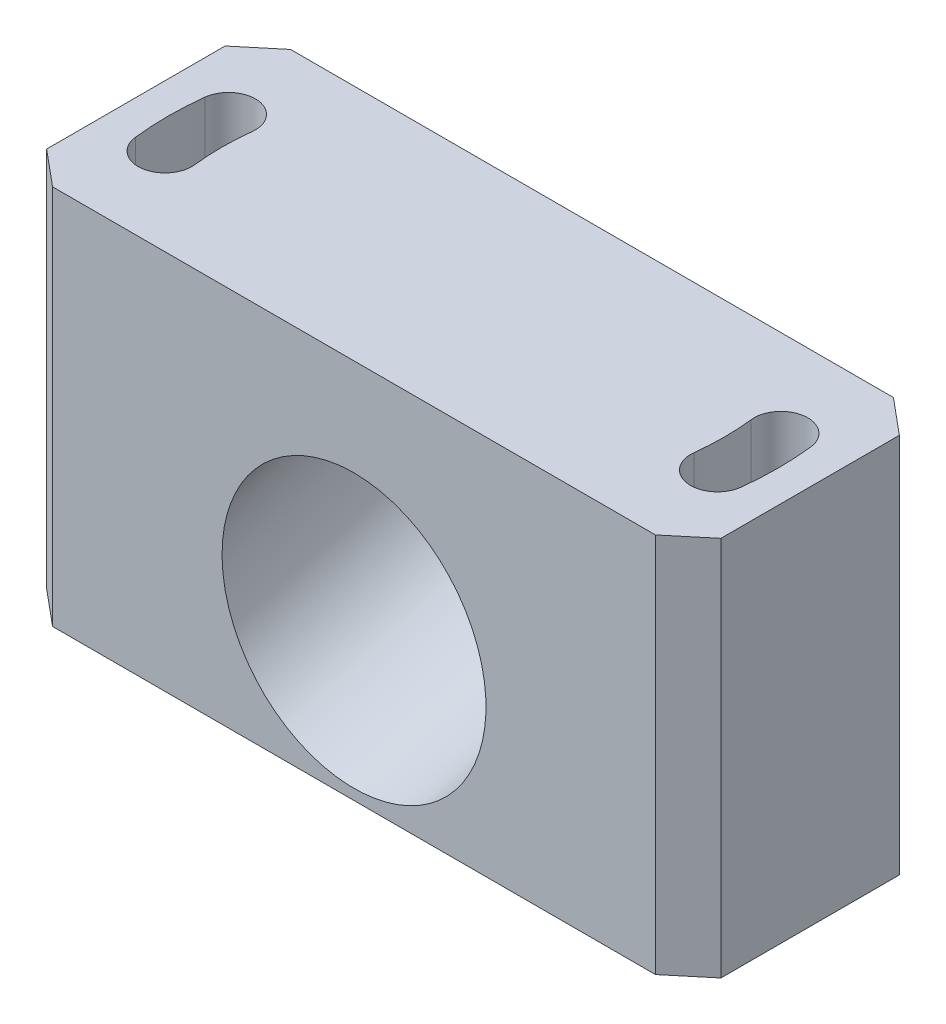
from build123d import *

# Parameters (mm, degrees)
SKETCH2_W           = 100
SKETCH2_H           = 55
BOSS_EXTRUDE1_DEPTH = 15
CUT_EXTRUDE2_DEPTH  = 76.828754441
SKETCH9_R           = 16.637
CUT_EXTRUDE3_DEPTH  = 70.869600016
CUT_EXTRUDE4_DEPTH  = 76.828754441
CUT_EXTRUDE5_DEPTH  = 76.828754441
SKETCH12_W          = 91
SKETCH12_H          = 35
CUT_EXTRUDE6_DEPTH  = 7


with BuildPart() as part:
    # Sketch2 → Boss-Extrude1 (new, symmetric)
    with BuildSketch(Plane.XY):
        Rectangle(SKETCH2_W, SKETCH2_H)
    extrude(amount=BOSS_EXTRUDE1_DEPTH, both=True)

    # Sketch5 → Cut-Extrude2 (cut, through all)
    with BuildSketch(Plane(origin=(0, 27.5, 0), x_dir=(1, 0, 0), z_dir=(0, 1, 0))):
        with BuildLine():
            ThreePointArc((-38.188858584, 4.386875892), (-38.44, 0), (-38.188858584, -4.386875892))
            ThreePointArc((-38.188858584, -4.386875892), (-34.434130699, -7.367851993), (-31.453154598, -3.613124108))
            ThreePointArc((-31.453154598, -3.613124108), (-31.66, 0), (-31.453154598, 3.613124108))
            ThreePointArc((-31.453154598, 3.613124108), (-34.434130699, 7.367851993), (-38.188858584, 4.386875892))
        make_face()
        with BuildLine():
            ThreePointArc((38.188858584, -4.386875892), (38.44, 0), (38.188858584, 4.386875892))
            ThreePointArc((38.188858584, 4.386875892), (34.434130699, 7.367851993), (31.453154598, 3.613124108))
            ThreePointArc((31.453154598, 3.613124108), (31.66, 0), (31.453154598, -3.613124108))
            ThreePointArc((31.453154598, -3.613124108), (34.434130699, -7.367851993), (38.188858584, -4.386875892))
        make_face()
    extrude(amount=-CUT_EXTRUDE2_DEPTH, mode=Mode.SUBTRACT)

    # Sketch9 → Cut-Extrude3 (cut, through all)
    with BuildSketch(Plane(origin=(0, 5.592150698, -20.870190528), x_dir=(-1, 0, 0), z_dir=(0, 0.25881904510252135, -0.9659258262890681))):
        with Locations(Location((0, 2, 0), (0, 0, 90))):
            Circle(SKETCH9_R)
    extrude(amount=-CUT_EXTRUDE3_DEPTH, mode=Mode.SUBTRACT)

    # Sketch10 → Cut-Extrude4 (cut, through all)
    with BuildSketch(Plane(origin=(0, 27.5, 0), x_dir=(1, 0, 0), z_dir=(0, 1, 0))):
        Polygon((50, 5), (50, 15), (38, 15), align=None)
        Polygon((50, -15), (50, -5), (38, -15), align=None)
        Polygon((-38, -15), (-50, -5), (-50, -15), align=None)
        Polygon((-50, 5), (-38, 15), (-50, 15), align=None)
    extrude(amount=-CUT_EXTRUDE4_DEPTH, mode=Mode.SUBTRACT)

    # Sketch11 → Cut-Extrude5 (cut, through all)
    with BuildSketch(Plane(origin=(0, 27.5, 0), x_dir=(1, 0, 0), z_dir=(0, 1, 0))):
        Polygon((-42.5, 11.25), (-42.5, -11.25), (-50, -5), (-50, 5), align=None)
        Polygon((42.5, 11.25), (42.5, -11.25), (50, -5), (50, 5), align=None)
    extrude(amount=-CUT_EXTRUDE5_DEPTH, mode=Mode.SUBTRACT)

    # Sketch12 → Cut-Extrude6 (cut)
    with BuildSketch(Plane.XZ.offset(27.5)):
        Rectangle(SKETCH12_W, SKETCH12_H)
    extrude(amount=-CUT_EXTRUDE6_DEPTH, mode=Mode.SUBTRACT)


solid = part.part
